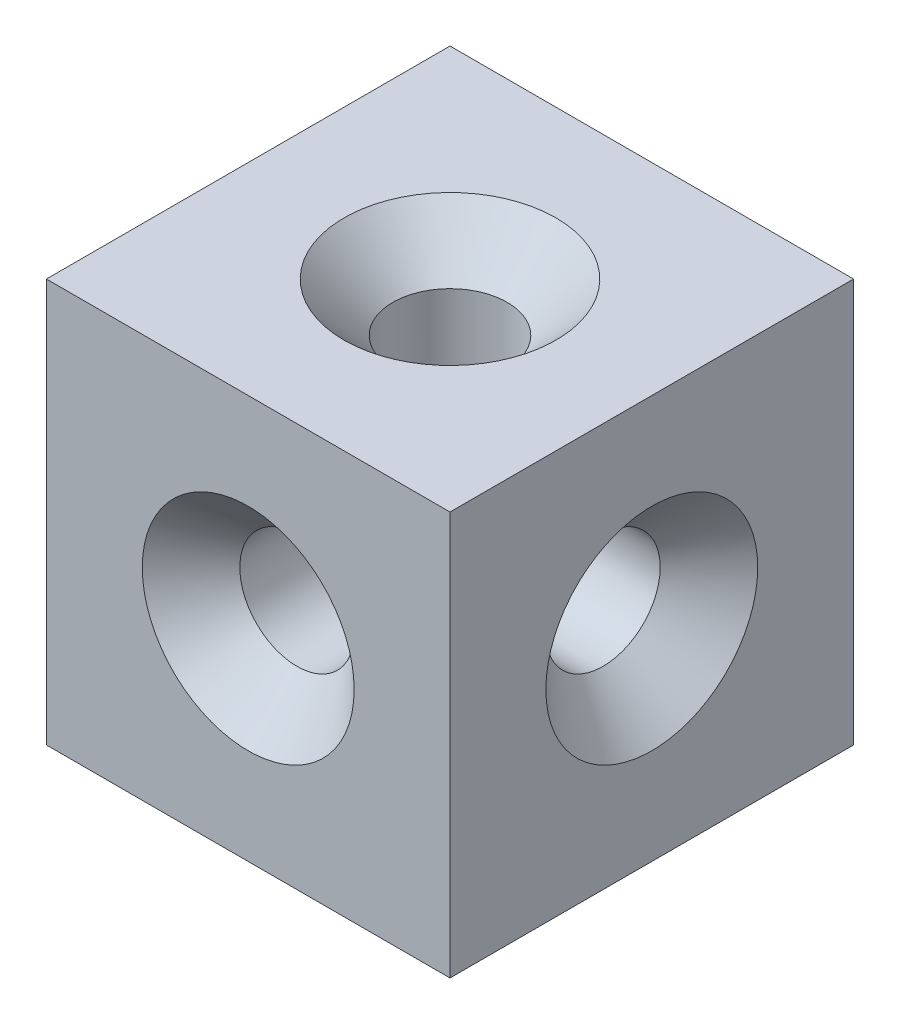
from build123d import *

# Parameters (mm, degrees)
SKETCH1_W                                       = 12
SKETCH1_H                                       = 12
BOSS_EXTRUDE1_DEPTH                             = 6
CSK_FOR_M3_FLAT_HEAD_MACHINE_SCREW1_D           = 3.4
CSK_FOR_M3_FLAT_HEAD_MACHINE_SCREW1_DEPTH       = 6
CSK_FOR_M3_FLAT_HEAD_MACHINE_SCREW1_CSINK_D     = 6.3
CSK_FOR_M3_FLAT_HEAD_MACHINE_SCREW1_CSINK_ANGLE = 90
CSK_FOR_M3_FLAT_HEAD_MACHINE_SCREW1_TIP         = 1.021463052
CSK_FOR_M3_FLAT_HEAD_MACHINE_SCREW2_D           = 3.4
CSK_FOR_M3_FLAT_HEAD_MACHINE_SCREW2_DEPTH       = 6
CSK_FOR_M3_FLAT_HEAD_MACHINE_SCREW2_CSINK_D     = 6.3
CSK_FOR_M3_FLAT_HEAD_MACHINE_SCREW2_CSINK_ANGLE = 90
CSK_FOR_M3_FLAT_HEAD_MACHINE_SCREW2_TIP         = 1.021463052
CSK_FOR_M3_FLAT_HEAD_MACHINE_SCREW3_D           = 3.4
CSK_FOR_M3_FLAT_HEAD_MACHINE_SCREW3_DEPTH       = 6
CSK_FOR_M3_FLAT_HEAD_MACHINE_SCREW3_CSINK_D     = 6.3
CSK_FOR_M3_FLAT_HEAD_MACHINE_SCREW3_CSINK_ANGLE = 90
CSK_FOR_M3_FLAT_HEAD_MACHINE_SCREW3_TIP         = 1.021463052
CSK_FOR_M3_FLAT_HEAD_MACHINE_SCREW7_D           = 3.4
CSK_FOR_M3_FLAT_HEAD_MACHINE_SCREW7_DEPTH       = 6
CSK_FOR_M3_FLAT_HEAD_MACHINE_SCREW7_CSINK_D     = 6.3
CSK_FOR_M3_FLAT_HEAD_MACHINE_SCREW7_CSINK_ANGLE = 90
CSK_FOR_M3_FLAT_HEAD_MACHINE_SCREW7_TIP         = 1.021463052
CSK_FOR_M3_FLAT_HEAD_MACHINE_SCREW8_D           = 3.4
CSK_FOR_M3_FLAT_HEAD_MACHINE_SCREW8_DEPTH       = 6
CSK_FOR_M3_FLAT_HEAD_MACHINE_SCREW8_CSINK_D     = 6.3
CSK_FOR_M3_FLAT_HEAD_MACHINE_SCREW8_CSINK_ANGLE = 90
CSK_FOR_M3_FLAT_HEAD_MACHINE_SCREW8_TIP         = 1.021463052
CSK_FOR_M3_FLAT_HEAD_MACHINE_SCREW9_D           = 3.4
CSK_FOR_M3_FLAT_HEAD_MACHINE_SCREW9_DEPTH       = 6
CSK_FOR_M3_FLAT_HEAD_MACHINE_SCREW9_CSINK_D     = 6.3
CSK_FOR_M3_FLAT_HEAD_MACHINE_SCREW9_CSINK_ANGLE = 90
CSK_FOR_M3_FLAT_HEAD_MACHINE_SCREW9_TIP         = 1.021463052


with BuildPart() as part:
    # Sketch1 → Boss-Extrude1 (new, symmetric)
    with BuildSketch(Plane.XY):
        Rectangle(SKETCH1_W, SKETCH1_H)
    extrude(amount=BOSS_EXTRUDE1_DEPTH, both=True)

    # CSK for M3 Flat Head Machine Screw1
    with Locations(Plane.XY.offset(6)):
        with Locations((0, 0)):
            CounterSinkHole(CSK_FOR_M3_FLAT_HEAD_MACHINE_SCREW1_D / 2, CSK_FOR_M3_FLAT_HEAD_MACHINE_SCREW1_CSINK_D / 2, depth=CSK_FOR_M3_FLAT_HEAD_MACHINE_SCREW1_DEPTH, counter_sink_angle=CSK_FOR_M3_FLAT_HEAD_MACHINE_SCREW1_CSINK_ANGLE)
            with Locations((0, 0, -(CSK_FOR_M3_FLAT_HEAD_MACHINE_SCREW1_DEPTH + CSK_FOR_M3_FLAT_HEAD_MACHINE_SCREW1_TIP / 2))):  # 118° drill point
                Cone(0, CSK_FOR_M3_FLAT_HEAD_MACHINE_SCREW1_D / 2, CSK_FOR_M3_FLAT_HEAD_MACHINE_SCREW1_TIP, mode=Mode.SUBTRACT)

    # CSK for M3 Flat Head Machine Screw2
    with Locations(Plane(origin=(6, 0, 0), x_dir=(0, 0, -1), z_dir=(1, 0, 0))):
        with Locations((0, 0)):
            CounterSinkHole(CSK_FOR_M3_FLAT_HEAD_MACHINE_SCREW2_D / 2, CSK_FOR_M3_FLAT_HEAD_MACHINE_SCREW2_CSINK_D / 2, depth=CSK_FOR_M3_FLAT_HEAD_MACHINE_SCREW2_DEPTH, counter_sink_angle=CSK_FOR_M3_FLAT_HEAD_MACHINE_SCREW2_CSINK_ANGLE)
            with Locations((0, 0, -(CSK_FOR_M3_FLAT_HEAD_MACHINE_SCREW2_DEPTH + CSK_FOR_M3_FLAT_HEAD_MACHINE_SCREW2_TIP / 2))):  # 118° drill point
                Cone(0, CSK_FOR_M3_FLAT_HEAD_MACHINE_SCREW2_D / 2, CSK_FOR_M3_FLAT_HEAD_MACHINE_SCREW2_TIP, mode=Mode.SUBTRACT)

    # CSK for M3 Flat Head Machine Screw3
    with Locations(Plane(origin=(0, 0, -6), x_dir=(-1, 0, 0), z_dir=(0, 0, -1))):
        with Locations((0, 0)):
            CounterSinkHole(CSK_FOR_M3_FLAT_HEAD_MACHINE_SCREW3_D / 2, CSK_FOR_M3_FLAT_HEAD_MACHINE_SCREW3_CSINK_D / 2, depth=CSK_FOR_M3_FLAT_HEAD_MACHINE_SCREW3_DEPTH, counter_sink_angle=CSK_FOR_M3_FLAT_HEAD_MACHINE_SCREW3_CSINK_ANGLE)
            with Locations((0, 0, -(CSK_FOR_M3_FLAT_HEAD_MACHINE_SCREW3_DEPTH + CSK_FOR_M3_FLAT_HEAD_MACHINE_SCREW3_TIP / 2))):  # 118° drill point
                Cone(0, CSK_FOR_M3_FLAT_HEAD_MACHINE_SCREW3_D / 2, CSK_FOR_M3_FLAT_HEAD_MACHINE_SCREW3_TIP, mode=Mode.SUBTRACT)

    # CSK for M3 Flat Head Machine Screw7
    with Locations(Plane.ZY.offset(6)):
        with Locations((0, 0)):
            CounterSinkHole(CSK_FOR_M3_FLAT_HEAD_MACHINE_SCREW7_D / 2, CSK_FOR_M3_FLAT_HEAD_MACHINE_SCREW7_CSINK_D / 2, depth=CSK_FOR_M3_FLAT_HEAD_MACHINE_SCREW7_DEPTH, counter_sink_angle=CSK_FOR_M3_FLAT_HEAD_MACHINE_SCREW7_CSINK_ANGLE)
            with Locations((0, 0, -(CSK_FOR_M3_FLAT_HEAD_MACHINE_SCREW7_DEPTH + CSK_FOR_M3_FLAT_HEAD_MACHINE_SCREW7_TIP / 2))):  # 118° drill point
                Cone(0, CSK_FOR_M3_FLAT_HEAD_MACHINE_SCREW7_D / 2, CSK_FOR_M3_FLAT_HEAD_MACHINE_SCREW7_TIP, mode=Mode.SUBTRACT)

    # CSK for M3 Flat Head Machine Screw8
    with Locations(Plane(origin=(0, 6, 0), x_dir=(1, 0, 0), z_dir=(0, 1, 0))):
        with Locations((0, 0)):
            CounterSinkHole(CSK_FOR_M3_FLAT_HEAD_MACHINE_SCREW8_D / 2, CSK_FOR_M3_FLAT_HEAD_MACHINE_SCREW8_CSINK_D / 2, depth=CSK_FOR_M3_FLAT_HEAD_MACHINE_SCREW8_DEPTH, counter_sink_angle=CSK_FOR_M3_FLAT_HEAD_MACHINE_SCREW8_CSINK_ANGLE)
            with Locations((0, 0, -(CSK_FOR_M3_FLAT_HEAD_MACHINE_SCREW8_DEPTH + CSK_FOR_M3_FLAT_HEAD_MACHINE_SCREW8_TIP / 2))):  # 118° drill point
                Cone(0, CSK_FOR_M3_FLAT_HEAD_MACHINE_SCREW8_D / 2, CSK_FOR_M3_FLAT_HEAD_MACHINE_SCREW8_TIP, mode=Mode.SUBTRACT)

    # CSK for M3 Flat Head Machine Screw9
    with Locations(Plane(origin=(0, -6, 0), x_dir=(-1, 0, 0), z_dir=(0, -1, 0))):
        with Locations((0, 0)):
            CounterSinkHole(CSK_FOR_M3_FLAT_HEAD_MACHINE_SCREW9_D / 2, CSK_FOR_M3_FLAT_HEAD_MACHINE_SCREW9_CSINK_D / 2, depth=CSK_FOR_M3_FLAT_HEAD_MACHINE_SCREW9_DEPTH, counter_sink_angle=CSK_FOR_M3_FLAT_HEAD_MACHINE_SCREW9_CSINK_ANGLE)
            with Locations((0, 0, -(CSK_FOR_M3_FLAT_HEAD_MACHINE_SCREW9_DEPTH + CSK_FOR_M3_FLAT_HEAD_MACHINE_SCREW9_TIP / 2))):  # 118° drill point
                Cone(0, CSK_FOR_M3_FLAT_HEAD_MACHINE_SCREW9_D / 2, CSK_FOR_M3_FLAT_HEAD_MACHINE_SCREW9_TIP, mode=Mode.SUBTRACT)


solid = part.part
